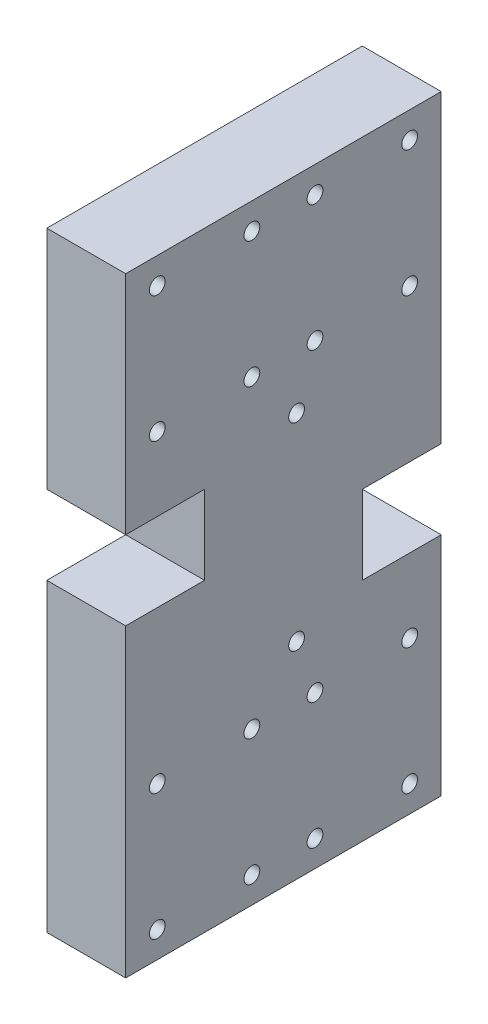
from build123d import *

# Parameters (mm, degrees)
CROQUIS1_W              = 60
CROQUIS1_H              = 116
CROQUIS1_R              = 1.5
SALIENTE_EXTRUIR1_DEPTH = 15
CROQUIS2_W              = 15
CROQUIS2_H              = 15
CORTAR_EXTRUIR1_DEPTH   = 132.457217375


with BuildPart() as part:
    # Croquis1 → Saliente-Extruir1 (new body)
    with BuildSketch(Plane(origin=(0, 0, 0), x_dir=(0, 0, -1), z_dir=(1, 0, 0))):
        with Locations((30, 58)):
            Rectangle(CROQUIS1_W, CROQUIS1_H)
        with Locations((54, 5)):
            Circle(CROQUIS1_R, mode=Mode.SUBTRACT)
        with Locations((36, 5)):
            Circle(CROQUIS1_R, mode=Mode.SUBTRACT)
        with Locations((36, 29)):
            Circle(CROQUIS1_R, mode=Mode.SUBTRACT)
        with Locations((54, 29)):
            Circle(CROQUIS1_R, mode=Mode.SUBTRACT)
        with Locations(Location((24, 29, 0), (0, 0, 180))):
            Circle(CROQUIS1_R, mode=Mode.SUBTRACT)
        with Locations(Location((24, 5, 0), (0, 0, 180))):
            Circle(CROQUIS1_R, mode=Mode.SUBTRACT)
        with Locations(Location((6, 5, 0), (0, 0, 180))):
            Circle(CROQUIS1_R, mode=Mode.SUBTRACT)
        with Locations(Location((6, 29, 0), (0, 0, 180))):
            Circle(CROQUIS1_R, mode=Mode.SUBTRACT)
        with Locations((6, 87)):
            Circle(CROQUIS1_R, mode=Mode.SUBTRACT)
        with Locations((6, 111)):
            Circle(CROQUIS1_R, mode=Mode.SUBTRACT)
        with Locations((24, 111)):
            Circle(CROQUIS1_R, mode=Mode.SUBTRACT)
        with Locations((24, 87)):
            Circle(CROQUIS1_R, mode=Mode.SUBTRACT)
        with Locations(Location((36, 87, 0), (0, 0, 180))):
            Circle(CROQUIS1_R, mode=Mode.SUBTRACT)
        with Locations(Location((36, 111, 0), (0, 0, 180))):
            Circle(CROQUIS1_R, mode=Mode.SUBTRACT)
        with Locations(Location((54, 111, 0), (0, 0, 180))):
            Circle(CROQUIS1_R, mode=Mode.SUBTRACT)
        with Locations(Location((54, 87, 0), (0, 0, 180))):
            Circle(CROQUIS1_R, mode=Mode.SUBTRACT)
        with Locations((32.5, 76.8)):
            Circle(CROQUIS1_R, mode=Mode.SUBTRACT)
        with Locations((32.5, 39.2)):
            Circle(CROQUIS1_R, mode=Mode.SUBTRACT)
    extrude(amount=SALIENTE_EXTRUIR1_DEPTH)

    # Croquis2 → Cortar-Extruir1 (cut, through all)
    with BuildSketch(Plane(origin=(15, 0, 0), x_dir=(0, 0, -1), z_dir=(1, 0, 0))):
        with Locations((7.5, 65.5)):
            Rectangle(CROQUIS2_W, CROQUIS2_H)
        with Locations((52.5, 50.5)):
            Rectangle(CROQUIS2_W, CROQUIS2_H)
    extrude(amount=-CORTAR_EXTRUIR1_DEPTH, mode=Mode.SUBTRACT)


solid = part.part
